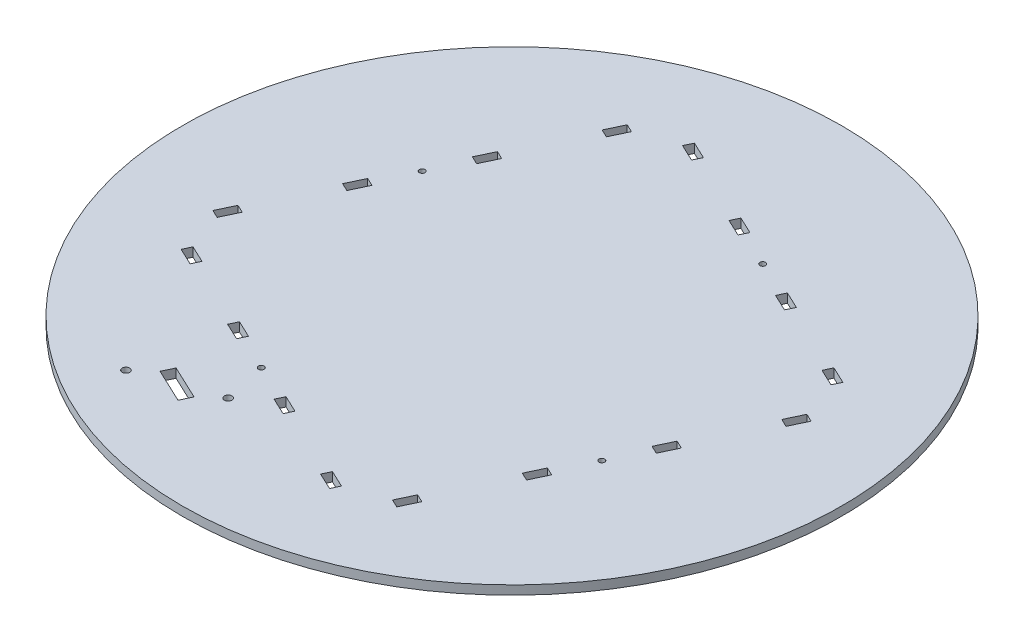
from build123d import *

# Parameters (mm, degrees)
SKETCH1_R           = 175
BOSS_EXTRUDE1_DEPTH = 4.75
CUT_EXTRUDE1_DEPTH  = 4.75
SKETCH4_R           = 2
CUT_EXTRUDE2_DEPTH  = 248.532952352
SKETCH5_R           = 1.5
CUT_EXTRUDE3_DEPTH  = 248.532952352


with BuildPart() as part:
    # Sketch1 → Boss-Extrude1 (new body)
    with BuildSketch(Plane(origin=(0, 0, 0), x_dir=(1, 0, 0), z_dir=(0, 1, 0))):
        with Locations(Location((0, 0, 0), (0, 0, 270))):
            Circle(SKETCH1_R)
    extrude(amount=BOSS_EXTRUDE1_DEPTH)

    # Sketch2 → Cut-Extrude1 (cut)
    with BuildSketch(Plane(origin=(0, 4.75, 0), x_dir=(1, 0, 0), z_dir=(0, 1, 0))):
        Polygon((33.00597779, -123.564301803), (23.964219805, -119.29269642), (21.935207248, -123.587531462), (30.976965232, -127.859136846), align=None)
        Polygon((-13.785119779, -101.458743944), (-22.826877764, -97.18713856), (-24.855890321, -101.481973603), (-15.814132337, -105.753578986), align=None)
        Polygon((-107.367314918, -57.247628225), (-116.409072902, -52.976022841), (-118.438085459, -57.270857884), (-109.396327475, -61.542463267), align=None)
        Polygon((-101.458743944, 13.785119779), (-97.18713856, 22.826877764), (-101.481973603, 24.855890321), (-105.753578986, 15.814132337), align=None)
        Polygon((-123.564301803, -33.00597779), (-119.29269642, -23.964219805), (-123.587531462, -21.935207248), (-127.859136846, -30.976965232), align=None)
        Polygon((107.367314918, 57.247628225), (116.409072902, 52.976022841), (118.438085459, 57.270857884), (109.396327475, 61.542463267), align=None)
        Polygon((-57.247628225, 107.367314918), (-52.976022841, 116.409072902), (-57.270857884, 118.438085459), (-61.542463267, 109.396327475), align=None)
        Polygon((60.576217349, 79.353186084), (69.617975333, 75.081580701), (71.64698789, 79.376415743), (62.605229906, 83.648021127), align=None)
        Polygon((13.785119779, 101.458743944), (22.826877764, 97.18713856), (24.855890321, 101.481973603), (15.814132337, 105.753578986), align=None)
        Polygon((-33.00597779, 123.564301803), (-23.964219805, 119.29269642), (-21.935207248, 123.587531462), (-30.976965232, 127.859136846), align=None)
        Polygon((-79.353186084, 60.576217349), (-75.081580701, 69.617975333), (-79.376415743, 71.64698789), (-83.648021127, 62.605229906), align=None)
        Polygon((-60.576217349, -79.353186084), (-69.617975333, -75.081580701), (-71.64698789, -79.376415743), (-62.605229906, -83.648021127), align=None)
        Polygon((123.564301803, 33.00597779), (119.29269642, 23.964219805), (123.587531462, 21.935207248), (127.859136846, 30.976965232), align=None)
        Polygon((101.458743944, -13.785119779), (97.18713856, -22.826877764), (101.481973603, -24.855890321), (105.753578986, -15.814132337), align=None)
        Polygon((79.353186084, -60.576217349), (75.081580701, -69.617975333), (79.376415743, -71.64698789), (83.648021127, -62.605229906), align=None)
        Polygon((57.247628225, -107.367314918), (52.976022841, -116.409072902), (57.270857884, -118.438085459), (61.542463267, -109.396327475), align=None)
    extrude(amount=-CUT_EXTRUDE1_DEPTH, mode=Mode.SUBTRACT)

    # Sketch4 → Cut-Extrude2 (cut, through all)
    with BuildSketch(Plane(origin=(0, 4.75, 0), x_dir=(1, 0, 0), z_dir=(0, 1, 0))):
        with Locations(Location((-77.507691728, -127.482700681, 0), (0, 0, 270))):
            Circle(SKETCH4_R)
        with Locations(Location((-37.567601624, -113.172242879, 0), (0, 0, 270))):
            Circle(SKETCH4_R)
        Polygon((-47.128974969, -121.705714608), (-65.212490938, -113.162503842), (-67.946318383, -118.949228952), (-49.862802415, -127.492439718), align=None)
    extrude(amount=-CUT_EXTRUDE2_DEPTH, mode=Mode.SUBTRACT)

    # Sketch5 → Cut-Extrude3 (cut, through all)
    with BuildSketch(Plane(origin=(0, 4.75, 0), x_dir=(1, 0, 0), z_dir=(0, 1, 0))):
        with Locations(Location((42.716053835, 90.417579844, 0), (0, 0, 270))):
            Circle(SKETCH5_R)
        with Locations(Location((90.417579844, -42.716053835, 0), (0, 0, 270))):
            Circle(SKETCH5_R)
        with Locations(Location((-42.716053835, -90.417579844, 0), (0, 0, 270))):
            Circle(SKETCH5_R)
        with Locations(Location((-90.417579844, 42.716053835, 0), (0, 0, 270))):
            Circle(SKETCH5_R)
    extrude(amount=-CUT_EXTRUDE3_DEPTH, mode=Mode.SUBTRACT)


solid = part.part
